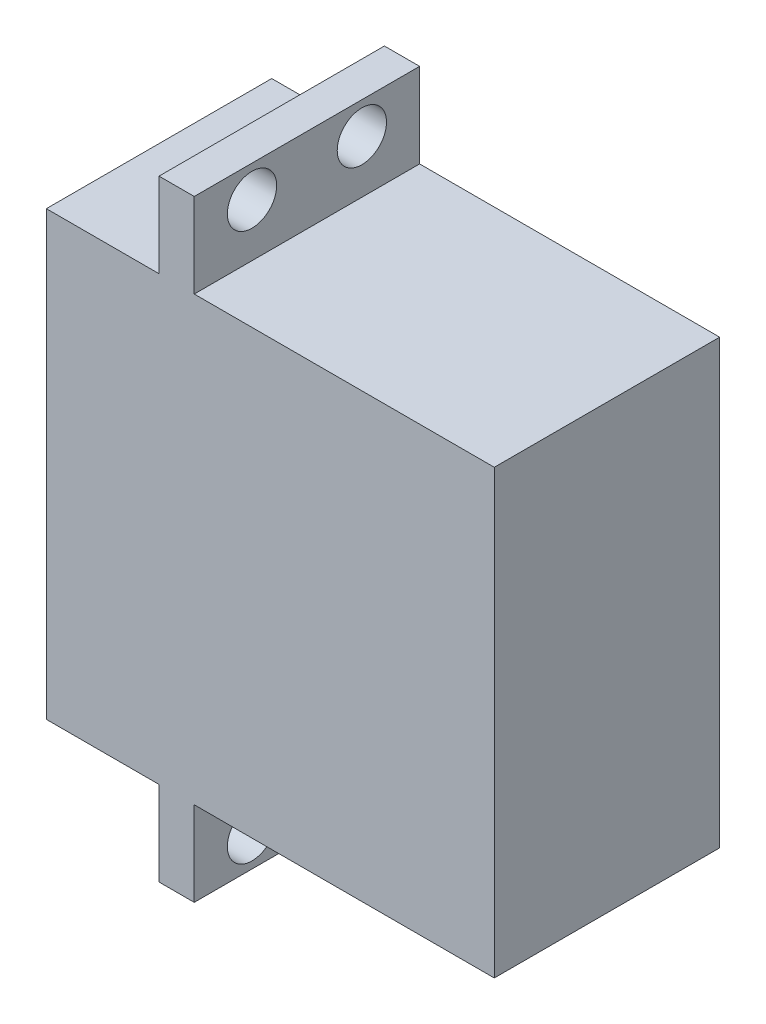
from build123d import *

# Parameters (mm, degrees)
SKETCH1_W           = 40.386
SKETCH1_H           = 39.878
BOSS_EXTRUDE1_DEPTH = 20.32
SKETCH2_R           = 2.9464
BOSS_EXTRUDE2_DEPTH = 5.08
SKETCH3_W           = 3.175
SKETCH3_H           = 20.32
BOSS_EXTRUDE3_DEPTH = 7.62
SKETCH4_W           = 3.175
SKETCH4_H           = 20.32
BOSS_EXTRUDE4_DEPTH = 7.62
SKETCH5_R           = 2.2225
CUT_EXTRUDE1_DEPTH  = 60.854602831
SKETCH6_R           = 1.5875
CUT_EXTRUDE2_DEPTH  = 6.35
SKETCH7_R           = 2.2225
CUT_EXTRUDE3_DEPTH  = 60.854602831


with BuildPart() as part:
    # Sketch1 → Boss-Extrude1 (new body)
    with BuildSketch(Plane.XY):
        with Locations((20.193, 19.939)):
            Rectangle(SKETCH1_W, SKETCH1_H)
    extrude(amount=BOSS_EXTRUDE1_DEPTH)

    # Sketch2 → Boss-Extrude2 (add)
    with BuildSketch(Plane.ZY):
        with Locations(Location((10.16, 30.607, 0), (0, 0, 90))):
            Circle(SKETCH2_R)
    extrude(amount=BOSS_EXTRUDE2_DEPTH)

    # Sketch3 → Boss-Extrude3 (add)
    with BuildSketch(Plane(origin=(0, 39.878, 0), x_dir=(1, 0, 0), z_dir=(0, 1, 0))):
        with Locations((11.7475, -10.16)):
            Rectangle(SKETCH3_W, SKETCH3_H)
    extrude(amount=BOSS_EXTRUDE3_DEPTH)

    # Sketch4 → Boss-Extrude4 (add)
    with BuildSketch(Plane.XZ):
        with Locations((11.7475, 10.16)):
            Rectangle(SKETCH4_W, SKETCH4_H)
    extrude(amount=BOSS_EXTRUDE4_DEPTH)

    # Sketch5 → Cut-Extrude1 (cut, through all)
    with BuildSketch(Plane.ZY.offset(-10.16)):
        with Locations((5.207, 44.6405)):
            Circle(SKETCH5_R)
        with Locations((15.113, 44.6405)):
            Circle(SKETCH5_R)
    extrude(amount=-CUT_EXTRUDE1_DEPTH, mode=Mode.SUBTRACT)

    # Sketch6 → Cut-Extrude2 (cut)
    with BuildSketch(Plane.ZY.offset(5.08)):
        with Locations((10.16, 30.607)):
            Circle(SKETCH6_R)
    extrude(amount=-CUT_EXTRUDE2_DEPTH, mode=Mode.SUBTRACT)

    # Sketch7 → Cut-Extrude3 (cut, through all)
    with BuildSketch(Plane.ZY.offset(-10.16)):
        with Locations((15.113, -4.7625)):
            Circle(SKETCH7_R)
        with Locations((5.207, -4.7625)):
            Circle(SKETCH7_R)
    extrude(amount=-CUT_EXTRUDE3_DEPTH, mode=Mode.SUBTRACT)


solid = part.part
